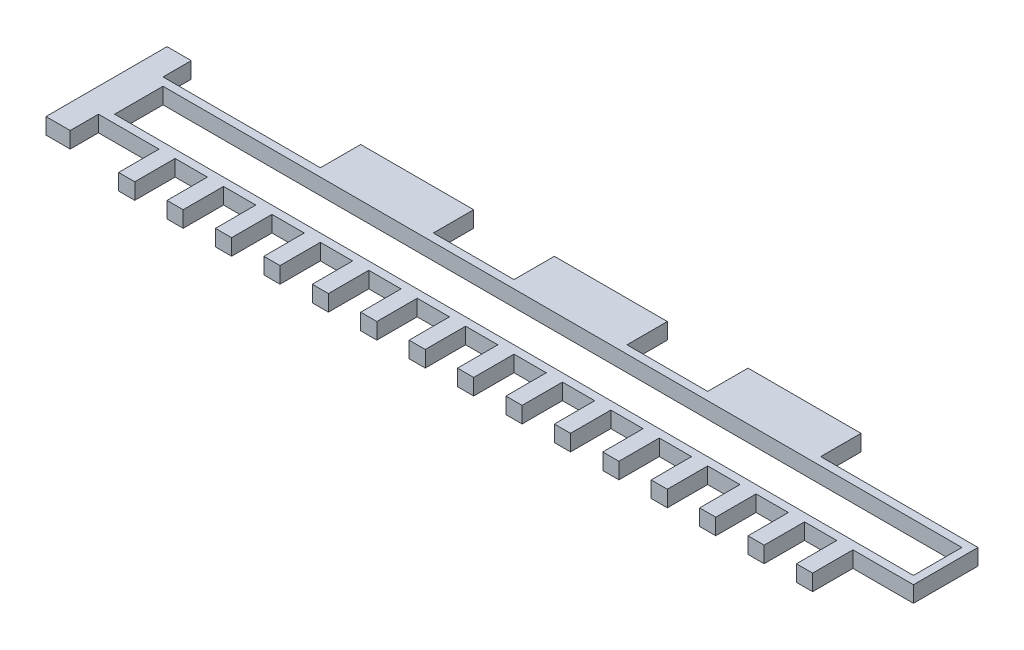
from build123d import *

# Parameters (mm, degrees)
SKETCH1_W           = 101
SKETCH1_H           = 8
SKETCH1_W_2         = 99
SKETCH1_H_2         = 6
BOSS_EXTRUDE1_DEPTH = 2
SKETCH2_W           = 3
SKETCH2_H           = 15
SKETCH2_W_2         = 2
SKETCH2_H_2         = 5
SKETCH2_W_3         = 14
BOSS_EXTRUDE2_DEPTH = 2


with BuildPart() as part:
    # Sketch1 → Boss-Extrude1 (new body)
    with BuildSketch(Plane(origin=(0, 0, 0), x_dir=(1, 0, 0), z_dir=(0, 1, 0))):
        Rectangle(SKETCH1_W, SKETCH1_H)
        Rectangle(SKETCH1_W_2, SKETCH1_H_2, mode=Mode.SUBTRACT)
    extrude(amount=BOSS_EXTRUDE1_DEPTH)

    # Sketch2 → Boss-Extrude2 (add)
    with BuildSketch(Plane(origin=(0, 0, 0), x_dir=(1, 0, 0), z_dir=(0, 1, 0))):
        with Locations((-52, 0)):
            Rectangle(SKETCH2_W, SKETCH2_H)
        with Locations((-42, -6.5)):
            Rectangle(SKETCH2_W_2, SKETCH2_H_2)
        with Locations((-36, -6.5)):
            Rectangle(SKETCH2_W_2, SKETCH2_H_2)
        with Locations((-30, -6.5)):
            Rectangle(SKETCH2_W_2, SKETCH2_H_2)
        with Locations((-24, -6.5)):
            Rectangle(SKETCH2_W_2, SKETCH2_H_2)
        with Locations((-18, -6.5)):
            Rectangle(SKETCH2_W_2, SKETCH2_H_2)
        with Locations((-12, -6.5)):
            Rectangle(SKETCH2_W_2, SKETCH2_H_2)
        with Locations((-6, -6.5)):
            Rectangle(SKETCH2_W_2, SKETCH2_H_2)
        with Locations((0, -6.5)):
            Rectangle(SKETCH2_W_2, SKETCH2_H_2)
        with Locations((6, -6.5)):
            Rectangle(SKETCH2_W_2, SKETCH2_H_2)
        with Locations((12, -6.5)):
            Rectangle(SKETCH2_W_2, SKETCH2_H_2)
        with Locations((18, -6.5)):
            Rectangle(SKETCH2_W_2, SKETCH2_H_2)
        with Locations((24, -6.5)):
            Rectangle(SKETCH2_W_2, SKETCH2_H_2)
        with Locations((30, -6.5)):
            Rectangle(SKETCH2_W_2, SKETCH2_H_2)
        with Locations((36, -6.5)):
            Rectangle(SKETCH2_W_2, SKETCH2_H_2)
        with Locations((42, -6.5)):
            Rectangle(SKETCH2_W_2, SKETCH2_H_2)
        with Locations((-24, 6.5)):
            Rectangle(SKETCH2_W_3, SKETCH2_H_2)
        with Locations((0, 6.5)):
            Rectangle(SKETCH2_W_3, SKETCH2_H_2)
        with Locations((24, 6.5)):
            Rectangle(SKETCH2_W_3, SKETCH2_H_2)
    extrude(amount=BOSS_EXTRUDE2_DEPTH)


solid = part.part
